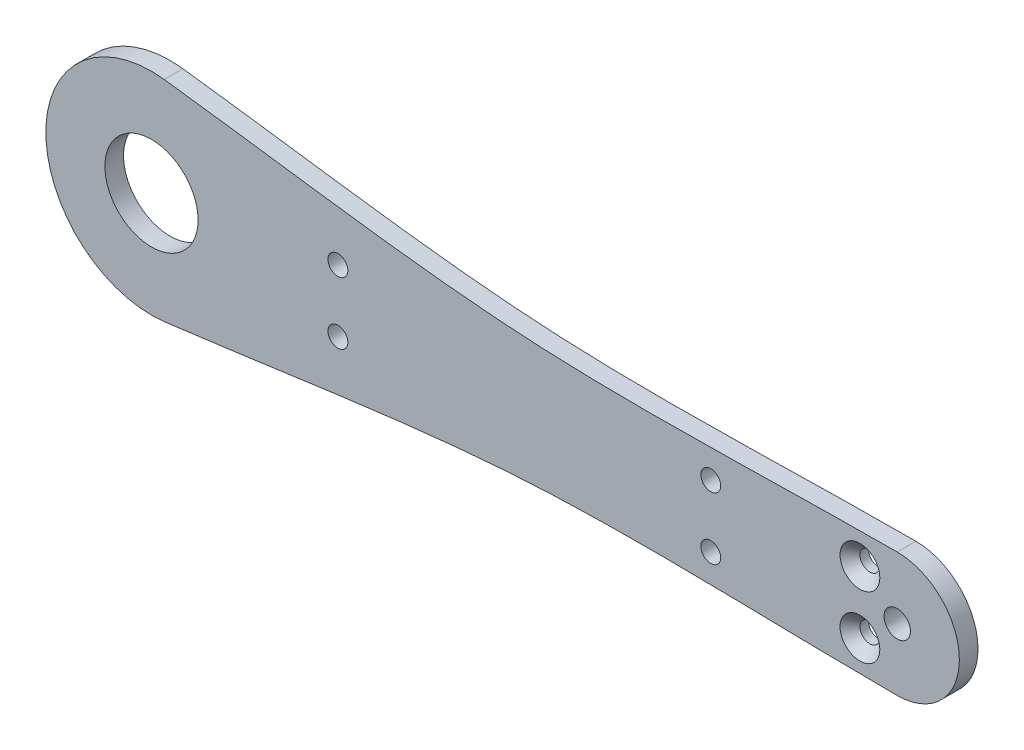
from build123d import *

# Parameters (mm, degrees)
SKETCH1_R           = 7.5
SKETCH1_R_2         = 2.125
SKETCH1_R_3         = 1.6
BOSS_EXTRUDE1_DEPTH = 3
SKETCH2_R           = 1.6
CUT_EXTRUDE1_DEPTH  = 79.91134278
CHAMFER1_SIZE       = 1.6


with BuildPart() as part:
    # Sketch1 → Boss-Extrude1 (new body)
    with BuildSketch(Plane.XY):
        with BuildLine():
            ThreePointArc((-57.956829007, 16.876772567), (-77, 0), (-57.956829007, -16.876772567))
            add(Edge.make_bspline(
                [(60, -10), (39.938279517, -10), (0.415985338, -7.693613776), (-38.598478023, -14.486949791), (-57.956829007, -16.876772567)],
                knots=[0, 0, 0, 0, 0.506913544, 1, 1, 1, 1], degree=3))
            ThreePointArc((60, -10), (70, 0), (60, 10))
            add(Edge.make_bspline(
                [(60, 10), (39.938279517, 10), (0.415985338, 7.693613776), (-38.598478023, 14.486949791), (-57.956829007, 16.876772567)],
                knots=[0, 0, 0, 0, 0.506913544, 1, 1, 1, 1], degree=3))
        make_face()
        with Locations((-60, 0)):
            Circle(SKETCH1_R, mode=Mode.SUBTRACT)
        with Locations(Location((60, 0, 0), (0, 0, 180))):
            Circle(SKETCH1_R_2, mode=Mode.SUBTRACT)
        with Locations((-30, 5)):
            Circle(SKETCH1_R_3, mode=Mode.SUBTRACT)
        with Locations((30, 5)):
            Circle(SKETCH1_R_3, mode=Mode.SUBTRACT)
        with Locations((30, -5)):
            Circle(SKETCH1_R_3, mode=Mode.SUBTRACT)
        with Locations((-30, -5)):
            Circle(SKETCH1_R_3, mode=Mode.SUBTRACT)
    extrude(amount=BOSS_EXTRUDE1_DEPTH)

    # Sketch2 → Cut-Extrude1 (cut, through all)
    with BuildSketch(Plane.XY.offset(3)):
        with Locations((54, 5)):
            Circle(SKETCH2_R)
        with Locations(Location((54, -5, 0), (0, 0, 180))):
            Circle(SKETCH2_R)
    extrude(amount=-CUT_EXTRUDE1_DEPTH, mode=Mode.SUBTRACT)

    # Chamfer1
    chamfer1_edges = [part.edges().sort_by_distance(p)[0] for p in [
        (52.4, 5, 3),
        (55.6, -5, 3),
    ]]
    chamfer(chamfer1_edges, length=CHAMFER1_SIZE)


solid = part.part
